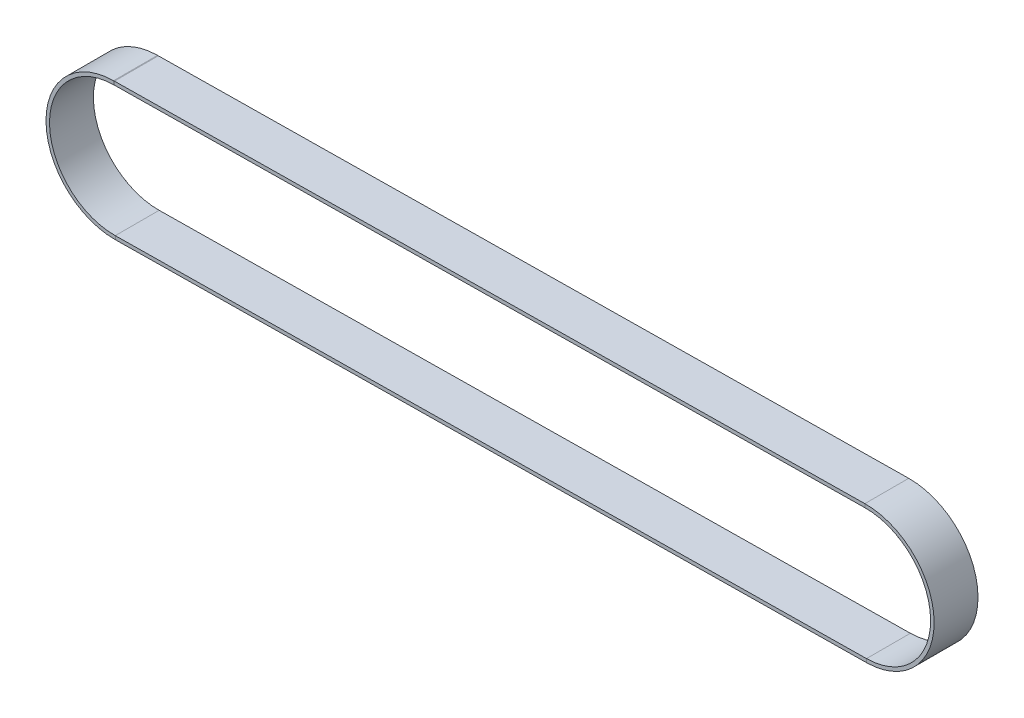
from build123d import *

# Parameters (mm, degrees)
SKETCH3_W = 25
SKETCH3_H = 2


with BuildPart() as part:
    # Sweep2: sweep along a path in Sketch2
    with BuildLine(Plane.XY) as sweep2_path:
        Line((-0.471284056, 37.997077405), (427.495798297, 43.305224142))
        ThreePointArc((427.495798297, 43.305224142), (465.964159759, 5.779430793), (428.43836641, -32.688930668))
        Line((428.43836641, -32.688930668), (0.471284056, -37.997077405))
        ThreePointArc((0.471284056, -37.997077405), (-37.997077405, -0.471284056), (-0.471284056, 37.997077405))
    # Sketch3 → Sweep2 (sweep)
    with BuildSketch(Plane(origin=(0, 0, 0), x_dir=(0, 0, -1), z_dir=(1, 0, 0))):
        with Locations((0, 37.997077405)):
            Rectangle(SKETCH3_W, SKETCH3_H)
    sweep(path=sweep2_path.line)


solid = part.part
